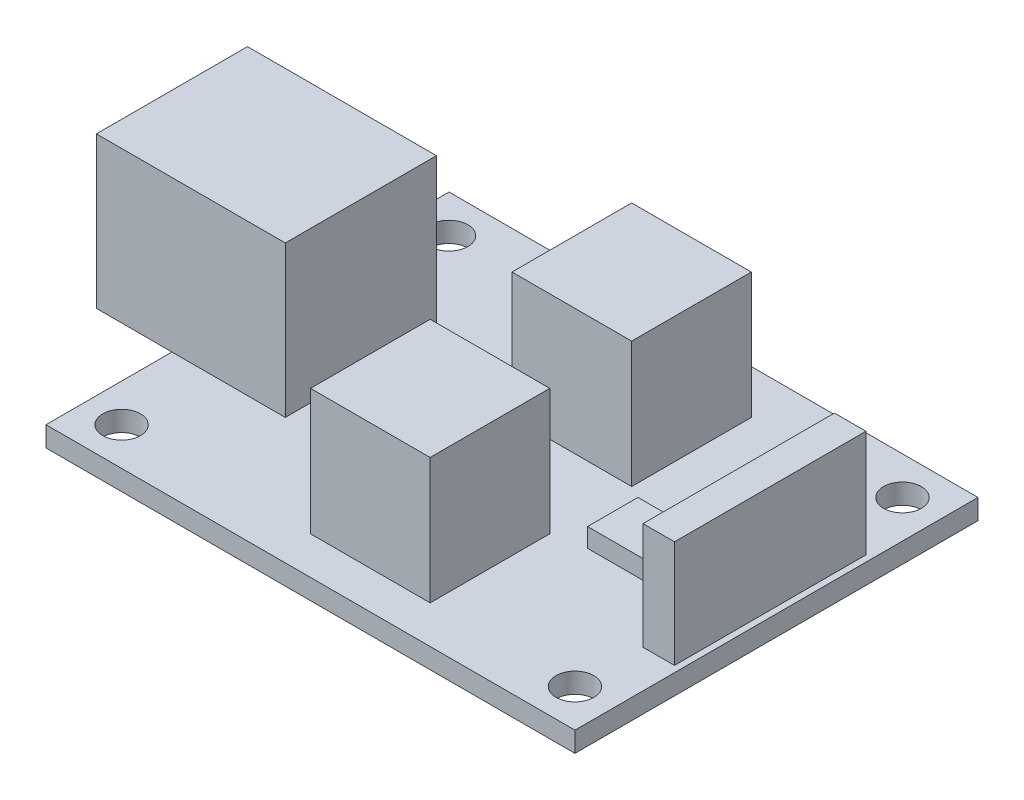
from build123d import *

# Parameters (mm, degrees)
SKETCH1_W               = 42
SKETCH1_H               = 32
PCB_DEPTH               = 1.6
MOUNT_HOLE_1_DEPTH      = 53.825751296
MOUNT_HOLE_1_DEPTH_BACK = 53.825751296
SKETCH2_R               = 1.5
MOUNT_HOLE_2_DEPTH      = 53.825751296
MOUNT_HOLE_2_DEPTH_BACK = 53.825751296
SKETCH3_R               = 1.5
MOUNT_HOLE_3_DEPTH      = 53.825751296
MOUNT_HOLE_3_DEPTH_BACK = 53.825751296
SKETCH4_R               = 1.5
MOUNT_HOLE_4_DEPTH      = 53.825751296
MOUNT_HOLE_4_DEPTH_BACK = 53.825751296
SKETCH5_R               = 1.5
BNC_SOCKET_START        = 1.6
SKETCH6_W               = 15
SKETCH6_H               = 12
BNC_SOCKET_DEPTH        = 12
OFFSET_POT_START        = 1.6
SKETCH7_W               = 9.5
SKETCH7_H               = 9.5
OFFSET_POT_DEPTH        = 10
LIMIT_POT_START         = 1.6
SKETCH8_W               = 9.5
SKETCH8_H               = 9.5
LIMIT_POT_DEPTH         = 10
OP_AMP_START            = 1.6
SKETCH9_W               = 5
SKETCH9_H               = 4
OP_AMP_DEPTH            = 1.5
HEADER_6PIN_START       = 1.6
SKETCH10_W              = 2.5
SKETCH10_H              = 15.2
HEADER_6PIN_DEPTH       = 8.5


with BuildPart() as part:
    # Sketch1 → PCB (new body)
    with BuildSketch(Plane(origin=(0, 0, 0), x_dir=(1, 0, 0), z_dir=(0, 1, 0))):
        with Locations((21, 16)):
            Rectangle(SKETCH1_W, SKETCH1_H)
    extrude(amount=PCB_DEPTH)

    # Sketch2 → Mount_hole_1 (cut, two sides: drawn at the far end of the back side and taken through both)
    with BuildSketch(Plane(origin=(0, 0, 0), x_dir=(1, 0, 0), z_dir=(0, 1, 0)).offset(-MOUNT_HOLE_1_DEPTH_BACK)):
        with Locations(Location((3, 3, 0), (0, 0, 270))):
            Circle(SKETCH2_R)
    extrude(amount=MOUNT_HOLE_1_DEPTH + MOUNT_HOLE_1_DEPTH_BACK, mode=Mode.SUBTRACT)

    # Sketch3 → Mount_hole_2 (cut, two sides: drawn at the far end of the back side and taken through both)
    with BuildSketch(Plane(origin=(0, 0, 0), x_dir=(1, 0, 0), z_dir=(0, 1, 0)).offset(-MOUNT_HOLE_2_DEPTH_BACK)):
        with Locations(Location((39, 3, 0), (0, 0, 270))):
            Circle(SKETCH3_R)
    extrude(amount=MOUNT_HOLE_2_DEPTH + MOUNT_HOLE_2_DEPTH_BACK, mode=Mode.SUBTRACT)

    # Sketch4 → Mount_hole_3 (cut, two sides: drawn at the far end of the back side and taken through both)
    with BuildSketch(Plane(origin=(0, 0, 0), x_dir=(1, 0, 0), z_dir=(0, 1, 0)).offset(-MOUNT_HOLE_3_DEPTH_BACK)):
        with Locations(Location((3, 29, 0), (0, 0, 270))):
            Circle(SKETCH4_R)
    extrude(amount=MOUNT_HOLE_3_DEPTH + MOUNT_HOLE_3_DEPTH_BACK, mode=Mode.SUBTRACT)

    # Sketch5 → Mount_hole_4 (cut, two sides: drawn at the far end of the back side and taken through both)
    with BuildSketch(Plane(origin=(0, 0, 0), x_dir=(1, 0, 0), z_dir=(0, 1, 0)).offset(-MOUNT_HOLE_4_DEPTH_BACK)):
        with Locations(Location((39, 29, 0), (0, 0, 270))):
            Circle(SKETCH5_R)
    extrude(amount=MOUNT_HOLE_4_DEPTH + MOUNT_HOLE_4_DEPTH_BACK, mode=Mode.SUBTRACT)

    # Sketch6 → BNC_socket (add)
    with BuildSketch(Plane(origin=(0, 0, 0), x_dir=(1, 0, 0), z_dir=(0, 1, 0)).offset(BNC_SOCKET_START)):
        with Locations((1.5, 16)):
            Rectangle(SKETCH6_W, SKETCH6_H)
    extrude(amount=BNC_SOCKET_DEPTH)

    # Sketch7 → Offset_pot (add)
    with BuildSketch(Plane(origin=(0, 0, 0), x_dir=(1, 0, 0), z_dir=(0, 1, 0)).offset(OFFSET_POT_START)):
        with Locations((22.75, 7.75)):
            Rectangle(SKETCH7_W, SKETCH7_H)
    extrude(amount=OFFSET_POT_DEPTH)

    # Sketch8 → Limit_pot (add)
    with BuildSketch(Plane(origin=(0, 0, 0), x_dir=(1, 0, 0), z_dir=(0, 1, 0)).offset(LIMIT_POT_START)):
        with Locations((22.75, 23.75)):
            Rectangle(SKETCH8_W, SKETCH8_H)
    extrude(amount=LIMIT_POT_DEPTH)

    # Sketch9 → Op_amp (add)
    with BuildSketch(Plane(origin=(0, 0, 0), x_dir=(1, 0, 0), z_dir=(0, 1, 0)).offset(OP_AMP_START)):
        with Locations((32.5, 15)):
            Rectangle(SKETCH9_W, SKETCH9_H)
    extrude(amount=OP_AMP_DEPTH)

    # Sketch10 → Header_6pin (add)
    with BuildSketch(Plane(origin=(0, 0, 0), x_dir=(1, 0, 0), z_dir=(0, 1, 0)).offset(HEADER_6PIN_START)):
        with Locations((40.25, 16)):
            Rectangle(SKETCH10_W, SKETCH10_H)
    extrude(amount=HEADER_6PIN_DEPTH)


solid = part.part
